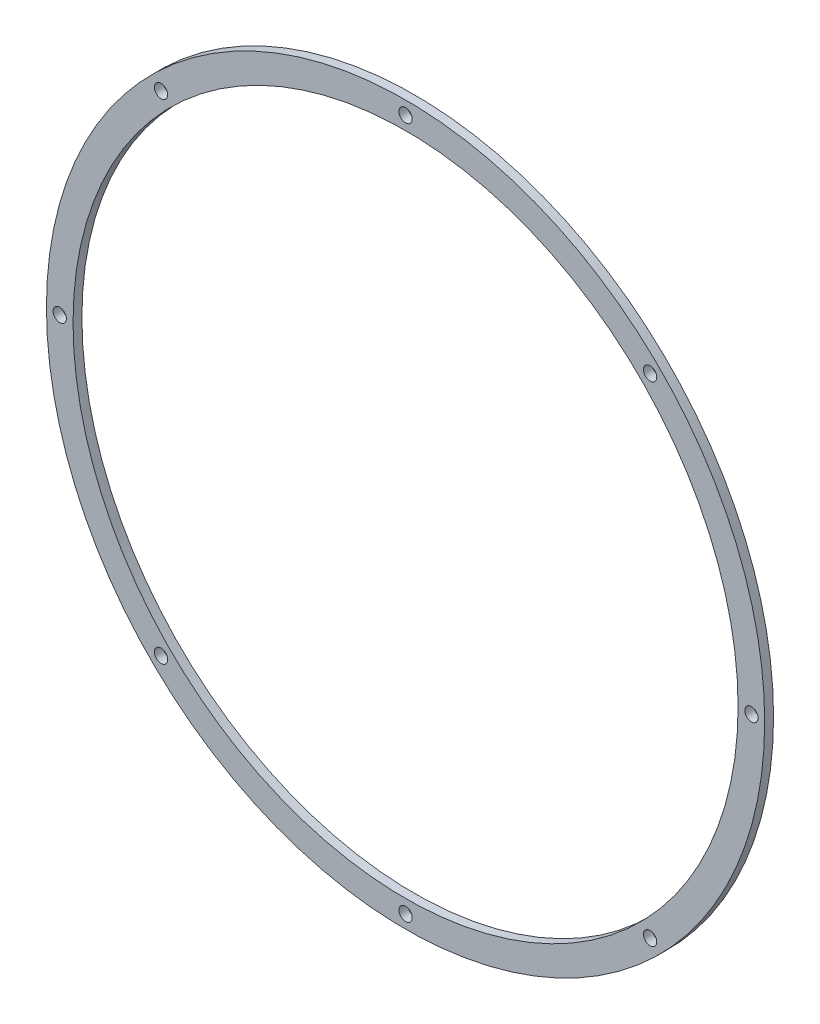
from build123d import *

# Parameters (mm, degrees)
SZKIC1_R                    = 81
SZKIC1_R_2                  = 75
DODANIE_WYCI_GNI_CIE1_DEPTH = 2
SZKIC2_R                    = 1.5
WYTNIJ_WYCI_GNI_CIE1_DEPTH  = 2
SZYK_KO_OWY1_COUNT          = 8


with BuildPart() as part:
    # Szkic1 → Dodanie-wyciągnięcie1 (new body)
    with BuildSketch(Plane.XY):
        Circle(SZKIC1_R)
        Circle(SZKIC1_R_2, mode=Mode.SUBTRACT)
    extrude(amount=DODANIE_WYCI_GNI_CIE1_DEPTH)

    # Szkic2 → Wytnij-wyciągnięcie1 (cut)
    with BuildSketch(Plane.XY.offset(2)):
        with Locations((0, 78)):
            Circle(SZKIC2_R)
    wytnij_wyci_gni_cie1 = extrude(amount=-WYTNIJ_WYCI_GNI_CIE1_DEPTH, mode=Mode.SUBTRACT)

    # Szyk kołowy1: Wytnij-wyciągnięcie1 ×8 about axis
    szyk_ko_owy1_axis = Axis((0, 0, 0), (0, 0, 1))
    for i in range(1, SZYK_KO_OWY1_COUNT):
        add(wytnij_wyci_gni_cie1.rotate(szyk_ko_owy1_axis, i * 360 / SZYK_KO_OWY1_COUNT), mode=Mode.SUBTRACT)


solid = part.part
